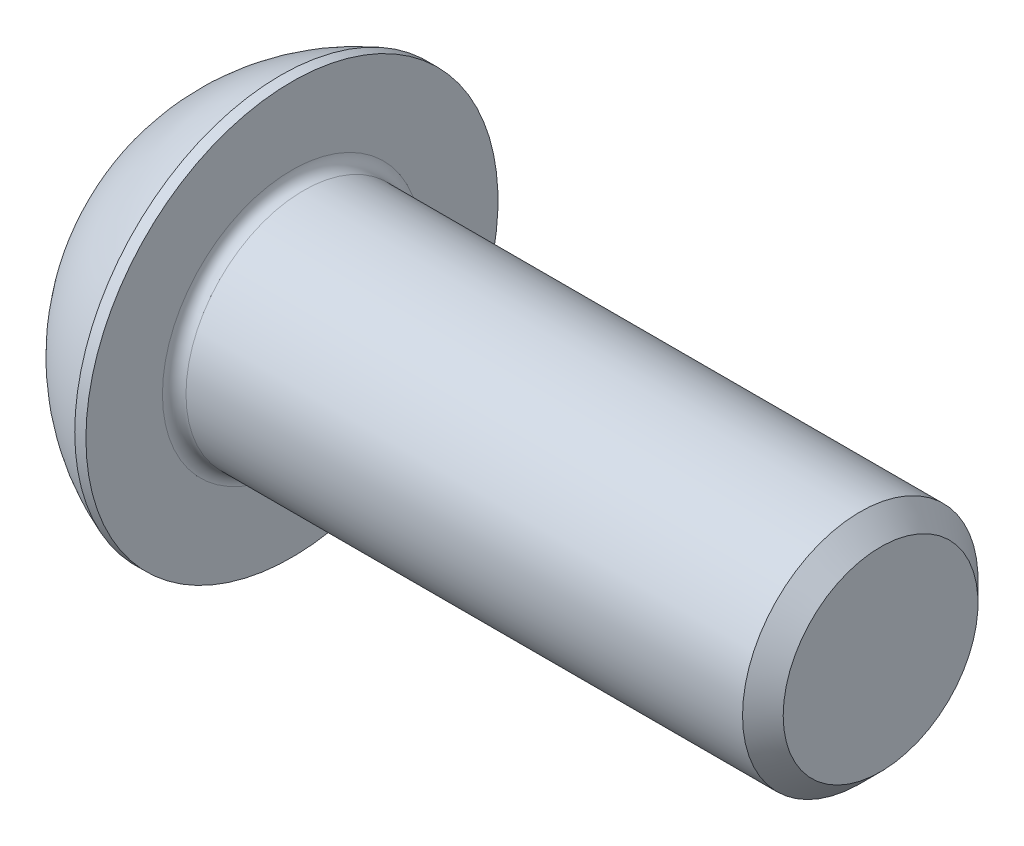
from build123d import *

# Parameters (mm, degrees)
FILLET1_R   = 0.4
HEX_2_DEPTH = 2.6


with BuildPart() as part:
    # BodySke → BaseBody (revolve)
    with BuildSketch(Plane.XY, mode=Mode.PRIVATE) as basebody_sk:
        with BuildLine():
            Line((24.4, 0), (24.4, 3.3095))
            Line((24.4, 3.3095), (23.7095, 4))
            Line((23.7095, 4), (4.4, 4))
            Line((4.4, 4), (4.4, 7))
            Line((4.4, 7), (4.02, 7))
            ThreePointArc((4.02, 7), (1.686451133, 5.621618984), (0, 3.5))
            Line((0, 3.5), (0, 0))
            Line((0, 0), (24.4, 0))
        make_face()
    revolve(basebody_sk.sketch.rotate(Axis((0, 0, 0), (1, 0, 0)), 90), axis=Axis((0, 0, 0), (1, 0, 0)))

    # Fillet1
    fillet1_edges = [part.edges().sort_by_distance(p)[0] for p in [
        (4.4, 0, -4),
    ]]
    fillet(fillet1_edges, radius=FILLET1_R)

    # Sketch2 → PreBroach (revolve, cut)
    with BuildSketch(Plane.XY, mode=Mode.PRIVATE) as prebroach_sk:
        Polygon((0, 2.5), (2.6, 2.5), (4.043375673, 0), (0, 0), align=None)
    revolve(prebroach_sk.sketch.rotate(Axis((0, 0, 0), (1, 0, 0)), 90), axis=Axis((0, 0, 0), (1, 0, 0)), mode=Mode.SUBTRACT)

    # Sketch3 → Hex 2 (cut)
    with BuildSketch(Plane(origin=(0, 0, 0), x_dir=(0, 0, -1), z_dir=(1, 0, 0))):
        Polygon((-2.5, -1.443375673), (-2.5, 1.443375673), (0, 2.886751346), (2.5, 1.443375673), (2.5, -1.443375673), (0, -2.886751346), align=None)
    extrude(amount=HEX_2_DEPTH, mode=Mode.SUBTRACT)


solid = part.part
